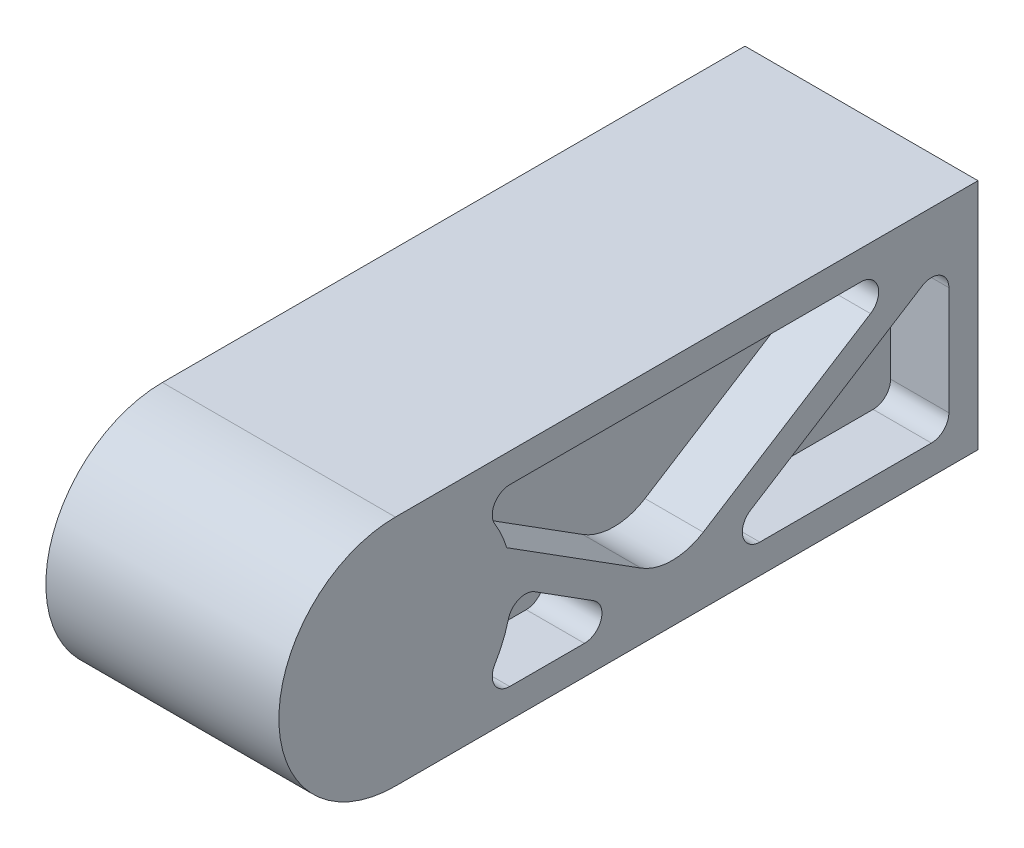
from build123d import *

# Parameters (mm, degrees)
BOSS_EXTRUDE1_DEPTH      = 20
BOSS_EXTRUDE1_DEPTH_BACK = 20
CUT_EXTRUDE1_START       = -10
CUT_EXTRUDE1_DEPTH       = 10
CUT_EXTRUDE3_DEPTH       = 10
FILLET1_R                = 3
FILLET2_R                = 10


with BuildPart() as part:
    # Sketch1 → Boss-Extrude1 (new, two sides: drawn at the far end of the back side and taken through both)
    with BuildSketch(Plane(origin=(0, 0, 0), x_dir=(0, 0, -1), z_dir=(1, 0, 0)).offset(-BOSS_EXTRUDE1_DEPTH_BACK)):
        with BuildLine():
            Line((-50, -20), (50, -20))
            Line((50, -20), (50, 20))
            Line((50, 20), (-50, 20))
            ThreePointArc((-50, 20), (-70, 0), (-50, -20))
        make_face()
    extrude(amount=BOSS_EXTRUDE1_DEPTH + BOSS_EXTRUDE1_DEPTH_BACK)

    # Sketch2 → Cut-Extrude1 (cut)
    with BuildSketch(Plane(origin=(20, 0, 0), x_dir=(0, 0, -1), z_dir=(1, 0, 0)).offset(CUT_EXTRUDE1_START)):
        Polygon((45, -15), (45, 12.043130914), (2.181709386, -15), align=None)
        with BuildLine():
            Line((-2.5, -12.043130914), (40.318290614, 15))
            Line((40.318290614, 15), (-36.771243445, 15))
            ThreePointArc((-36.771243445, 15), (-33.198235095, 10.848995164), (-30.885242753, 5.884390825))
            Line((-30.885242753, 5.884390825), (-2.5, -12.043130914))
        make_face()
        with BuildLine():
            Line((-36.771243445, -15), (-7.181709386, -15))
            Line((-7.181709386, -15), (-30.008501328, -0.583078774))
            ThreePointArc((-30.008501328, -0.583078774), (-31.893143736, -8.493630334), (-36.771243445, -15))
        make_face()
    extrude(amount=CUT_EXTRUDE1_DEPTH, mode=Mode.SUBTRACT)

    # Sketch4 → Cut-Extrude3 (cut)
    with BuildSketch(Plane.ZY.offset(20)):
        with BuildLine():
            Line((2.5, -12.043130914), (30.885242753, 5.884390825))
            ThreePointArc((30.885242753, 5.884390825), (33.198235095, 10.848995164), (36.771243445, 15))
            Line((36.771243445, 15), (-40.318290614, 15))
            Line((-40.318290614, 15), (2.5, -12.043130914))
        make_face()
        with BuildLine():
            Line((7.181709386, -15), (36.771243445, -15))
            ThreePointArc((36.771243445, -15), (31.893143736, -8.493630334), (30.008501328, -0.583078774))
            Line((30.008501328, -0.583078774), (7.181709386, -15))
        make_face()
        Polygon((-45, 12.043130914), (-45, -15), (-2.181709386, -15), align=None)
    extrude(amount=-CUT_EXTRUDE3_DEPTH, mode=Mode.SUBTRACT)

    # Fillet1
    fillet1_edges = [part.edges().sort_by_distance(p)[0] for p in [
        (-15, -0.583078774, 30.008501328),
        (-15, -15, 7.181709386),
        (-15, -15, 36.771243445),
        (-15, -15, -2.181709386),
        (-15, -15, -45),
        (-15, 12.043130914, -45),
        (-15, 15, -40.318290614),
        (-15, 15, 36.771243445),
        (15, -15, 36.771243445),
        (15, -0.583078774, 30.008501328),
        (15, -15, 7.181709386),
        (15, -15, -2.181709386),
        (15, -15, -45),
        (15, 12.043130914, -45),
        (15, 15, -40.318290614),
        (15, 15, 36.771243445),
    ]]
    fillet(fillet1_edges, radius=FILLET1_R)

    # Fillet2
    fillet2_edges = [part.edges().sort_by_distance(p)[0] for p in [
        (15, -12.043130914, 2.5),
        (-15, -12.043130914, 2.5),
    ]]
    fillet(fillet2_edges, radius=FILLET2_R)


solid = part.part
